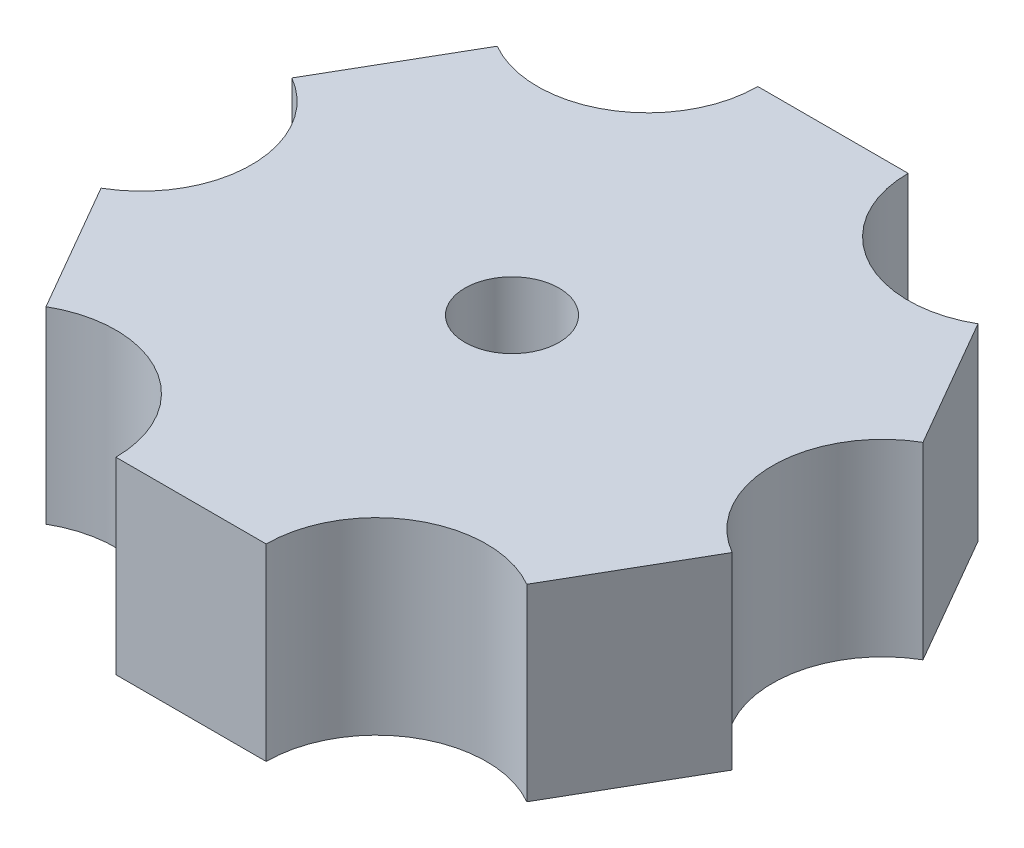
from build123d import *

# Parameters (mm, degrees)
SKETCH1_R           = 5
BOSS_EXTRUDE1_DEPTH = 20


with BuildPart() as part:
    # Sketch1 → Boss-Extrude1 (new body)
    with BuildSketch(Plane(origin=(0, 0, 0), x_dir=(1, 0, 0), z_dir=(0, 1, 0))):
        with BuildLine():
            Line((-7.979897677, 34.078163581), (7.979897677, 34.078163581))
            ThreePointArc((7.979897677, 34.078163581), (13.827467297, 23.949875898), (25.522606537, 23.949875898))
            Line((25.522606537, 23.949875898), (33.502504214, 10.128287683))
            ThreePointArc((33.502504214, 10.128287683), (27.654934594, 0), (33.502504214, -10.128287683))
            Line((33.502504214, -10.128287683), (25.522606537, -23.949875898))
            ThreePointArc((25.522606537, -23.949875898), (13.827467297, -23.949875898), (7.979897677, -34.078163581))
            Line((7.979897677, -34.078163581), (-7.979897677, -34.078163581))
            ThreePointArc((-7.979897677, -34.078163581), (-13.827467297, -23.949875898), (-25.522606537, -23.949875898))
            Line((-25.522606537, -23.949875898), (-33.502504214, -10.128287683))
            ThreePointArc((-33.502504214, -10.128287683), (-27.654934594, 0), (-33.502504214, 10.128287683))
            Line((-33.502504214, 10.128287683), (-25.522606537, 23.949875898))
            ThreePointArc((-25.522606537, 23.949875898), (-13.827467297, 23.949875898), (-7.979897677, 34.078163581))
        make_face()
        with Locations(Location((0, 0, 0), (0, 0, 270))):
            Circle(SKETCH1_R, mode=Mode.SUBTRACT)
    extrude(amount=BOSS_EXTRUDE1_DEPTH)


solid = part.part
